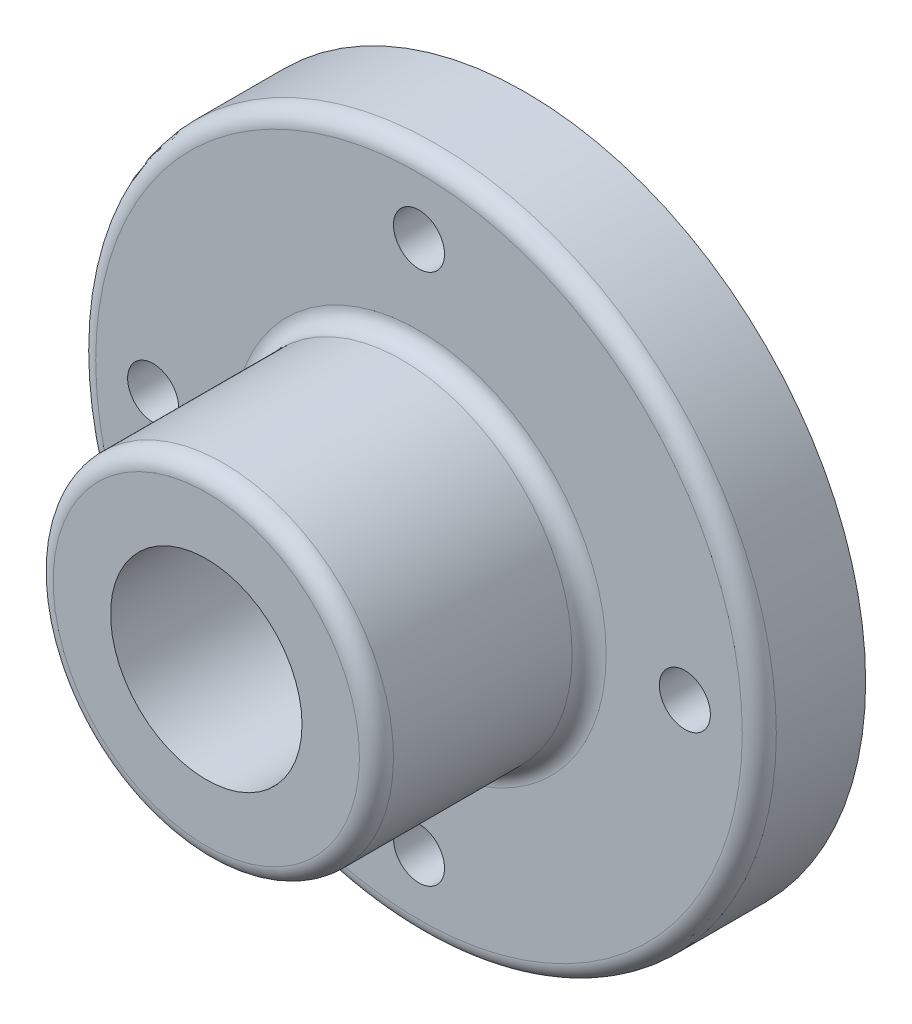
from build123d import *

# Parameters (mm, degrees)
ESQUISSE1_R         = 80
BASE_25MM_DEPTH     = 25
ESQUISSE1_4_R       = 40
AXE75MM_DEPTH       = 75
TROU1_REACH         = 137.739
ESQUISSE1_5_R       = 6
TROU2_REACH         = 137.739
ESQUISSE1_6_R       = 6
TROU3_4_REACH       = 137.739
ESQUISSE1_7_R       = 6
TROUPRINCIPAL_REACH = 137.739
ESQUISSE1_8_R       = 22.5
CONG_1_R            = 4
CONG_2_R            = 4
CONG_3_R            = 4


with BuildPart() as part:
    # Esquisse1 → Base 25mm (new body)
    with BuildSketch(Plane.XY):
        Circle(ESQUISSE1_R)
    extrude(amount=BASE_25MM_DEPTH)

    # Esquisse1<4> → axe75mm (add)
    with BuildSketch(Plane.XY):
        Circle(ESQUISSE1_4_R)
    extrude(amount=AXE75MM_DEPTH)

    # Esquisse1<5> → Trou1 (cut, up to next)
    with BuildSketch(Plane.XY, mode=Mode.PRIVATE) as trou1_sk1:
        with Locations((0, 62.5)):
            Circle(ESQUISSE1_5_R)
    trou1_tool1 = extrude(trou1_sk1.sketch, amount=TROU1_REACH, mode=Mode.PRIVATE) & part.part
    add(trou1_tool1.solids().sort_by_distance((0, 62.5, 0))[0], mode=Mode.SUBTRACT)

    # Esquisse1<6> → Trou2 (cut, up to next)
    with BuildSketch(Plane.XY, mode=Mode.PRIVATE) as trou2_sk1:
        with Locations((-62.5, 0)):
            Circle(ESQUISSE1_6_R)
    trou2_tool1 = extrude(trou2_sk1.sketch, amount=TROU2_REACH, mode=Mode.PRIVATE) & part.part
    add(trou2_tool1.solids().sort_by_distance((-62.5, 0, 0))[0], mode=Mode.SUBTRACT)

    # Esquisse1<7> → Trou3&4 (cut, up to next)
    with BuildSketch(Plane.XY, mode=Mode.PRIVATE) as trou3_4_sk1:
        with Locations((62.5, 0)):
            Circle(ESQUISSE1_7_R)
    trou3_4_tool1 = extrude(trou3_4_sk1.sketch, amount=TROU3_4_REACH, mode=Mode.PRIVATE) & part.part
    # Esquisse1<7> → Trou3&4 (cut, up to next)
    with BuildSketch(Plane.XY, mode=Mode.PRIVATE) as trou3_4_sk2:
        with Locations((0, -62.5)):
            Circle(ESQUISSE1_7_R)
    trou3_4_tool2 = extrude(trou3_4_sk2.sketch, amount=TROU3_4_REACH, mode=Mode.PRIVATE) & part.part
    add(trou3_4_tool1.solids().sort_by_distance((62.5, 0, 0))[0], mode=Mode.SUBTRACT)
    add(trou3_4_tool2.solids().sort_by_distance((0, -62.5, 0))[0], mode=Mode.SUBTRACT)

    # Esquisse1<8> → TrouPrincipal (cut, up to next)
    with BuildSketch(Plane.XY, mode=Mode.PRIVATE) as trouprincipal_sk1:
        Circle(ESQUISSE1_8_R)
    trouprincipal_tool1 = extrude(trouprincipal_sk1.sketch, amount=TROUPRINCIPAL_REACH, mode=Mode.PRIVATE) & part.part
    add(trouprincipal_tool1.solids().sort_by_distance((0, 0, 0))[0], mode=Mode.SUBTRACT)

    # Congé1
    cong_1_edges = [part.edges().sort_by_distance(p)[0] for p in [
        (-40, 0, 25),
    ]]
    fillet(cong_1_edges, radius=CONG_1_R)

    # Congé2
    cong_2_edges = [part.edges().sort_by_distance(p)[0] for p in [
        (-80, 0, 25),
    ]]
    fillet(cong_2_edges, radius=CONG_2_R)

    # Congé3
    cong_3_edges = [part.edges().sort_by_distance(p)[0] for p in [
        (-40, 0, 75),
    ]]
    fillet(cong_3_edges, radius=CONG_3_R)


solid = part.part
